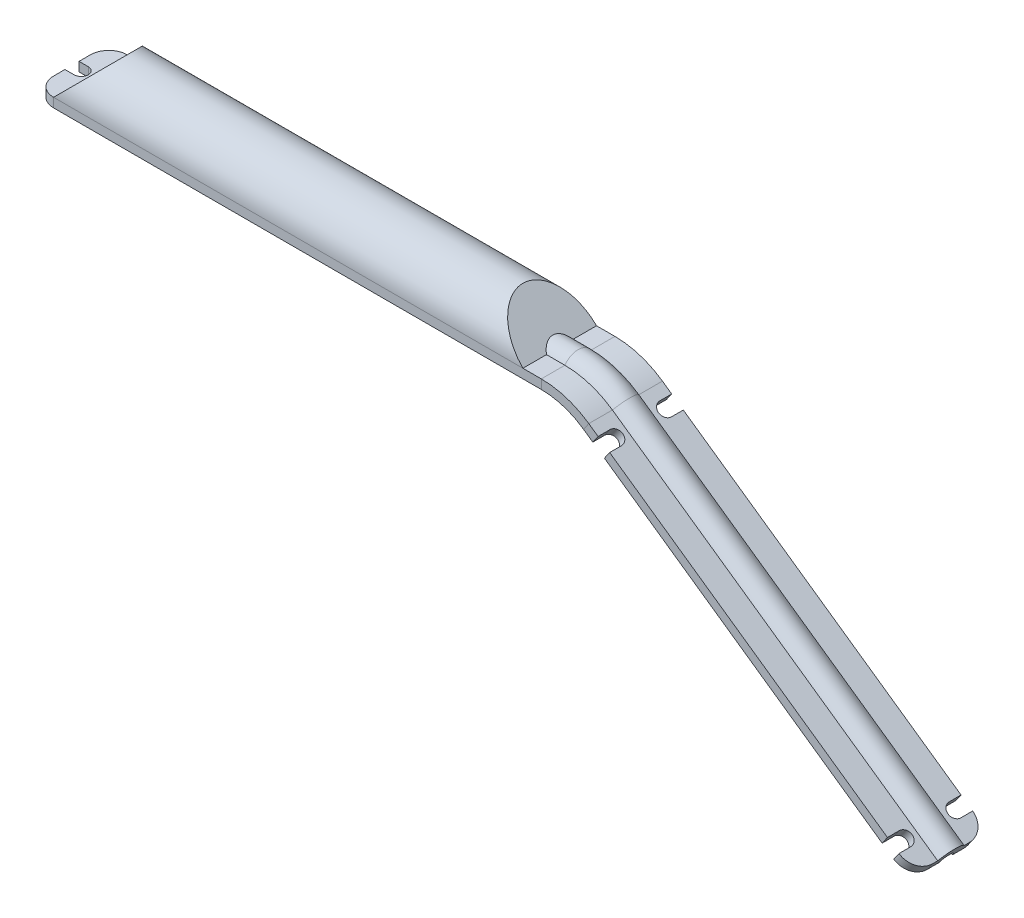
from build123d import *

# Parameters (mm, degrees)
BOSS_EXTRUDE1_DEPTH                          = 3.175
BOSS_EXTRUDE1_DEPTH_BACK                     = 80.9625
CUT_EXTRUDE1_DEPTH                           = 66.747999758
CUT_EXTRUDE2_REACH                           = 123.064
CUT_EXTRUDE2_OFFSET_FROM_SURFACE             = 1.5875
CUT_EXTRUDE2_DIRECTION_2_REACH               = 123.064
CUT_EXTRUDE2_DIRECTION_2_OFFSET_FROM_SURFACE = 1.5875
FILLET2_R                                    = 3.175
CUT_EXTRUDE3_DEPTH                           = 92.97528692
FILLET6_R                                    = 3.175
CUT_EXTRUDE6_DEPTH                           = 98.945839174


with BuildPart() as part:
    # Sketch15 → Boss-Extrude1 (new, two sides: drawn at the far end of the back side and taken through both)
    with BuildSketch(Plane(origin=(0, 0, 0), x_dir=(0, 0, -1), z_dir=(1, 0, 0)).offset(-BOSS_EXTRUDE1_DEPTH_BACK)):
        with BuildLine():
            Line((6.35, 0), (-6.35, 0))
            Line((-6.35, 0), (-6.35, 1.5875))
            ThreePointArc((-6.35, 1.5875), (0, 7.9375), (6.35, 1.5875))
            Line((6.35, 1.5875), (6.35, 0))
        make_face()
    extrude(amount=BOSS_EXTRUDE1_DEPTH + BOSS_EXTRUDE1_DEPTH_BACK)

    # Sketch16 → Cut-Extrude1 (cut, through all)
    with BuildSketch(Plane(origin=(-25.118523266, -23.516899887, -8.308460441), x_dir=(1, 0, 0), z_dir=(0, 0, -1))):
        Polygon((-55.843976734, -25.104399887), (-52.668976734, -25.104399887), (-46.318976734, -31.454399887), (-55.843976734, -31.454399887), align=None)
        Polygon((28.293523266, -31.454399887), (28.293523266, -25.104399887), (21.943523266, -31.454399887), align=None)
    extrude(amount=-CUT_EXTRUDE1_DEPTH, mode=Mode.SUBTRACT)

    # Sweep3: sweep along a path in Sketch2
    with BuildLine(Plane.XY) as sweep3_path:
        Line((-3.175, 0), (6.35, 0))
        ThreePointArc((6.35, 0), (10.168963654, -0.587794725), (13.634420742, -2.296769038))
        Line((13.634420742, -2.296769038), (69.749448553, -41.588934518))
    # Sketch1 → Sweep3 (sweep)
    with BuildSketch(Plane(origin=(0, -59.268822518, 0), x_dir=(0, 0, -1), z_dir=(-1, 0, 0))):
        with BuildLine():
            Line((-6.35, -59.268822518), (-1.190625, -59.268822518))
            ThreePointArc((-1.190625, -59.268822518), (0, -60.459447518), (1.190625, -59.268822518))
            Line((1.190625, -59.268822518), (6.35, -59.268822518))
            Line((6.35, -59.268822518), (6.35, -60.856322518))
            Line((6.35, -60.856322518), (2.2798733, -60.856322518))
            ThreePointArc((2.2798733, -60.856322518), (0, -62.046947518), (-2.2798733, -60.856322518))
            Line((-2.2798733, -60.856322518), (-6.35, -60.856322518))
            Line((-6.35, -60.856322518), (-6.35, -59.268822518))
        make_face()
    sweep(path=sweep3_path.line)

    # Cut-Extrude2: up to this face of the body (flat: up to its plane, moved by the offset)
    cut_extrude2_end = Plane(part.part.faces().sort_by_distance((0.338621943, 4.423878057, 0))[0]).offset(-CUT_EXTRUDE2_OFFSET_FROM_SURFACE)
    # Sketch17 → Cut-Extrude2 (cut, up to the picked face)
    with BuildSketch(Plane.ZY.offset(40.48125), mode=Mode.PRIVATE) as cut_extrude2_sk1:
        with BuildLine():
            Line((-4.7625, 0), (4.7625, 0))
            Line((4.7625, 0), (4.7625, 1.5875))
            ThreePointArc((4.7625, 1.5875), (0, 6.35), (-4.7625, 1.5875))
            Line((-4.7625, 1.5875), (-4.7625, 0))
        make_face()
    cut_extrude2_tool1 = split(extrude(cut_extrude2_sk1.sketch, amount=-CUT_EXTRUDE2_REACH, mode=Mode.PRIVATE), bisect_by=cut_extrude2_end, keep=Keep.BOTH, mode=Mode.PRIVATE)
    add(cut_extrude2_tool1.solids().sort_by(Axis((-40.48125, 2.770015, 0), (1, 0, 0)))[0], mode=Mode.SUBTRACT)

    # Cut-Extrude2 direction 2: up to this face of the body (flat: up to its plane, moved by the offset)
    cut_extrude2_direction_2_end = Plane(part.part.faces().sort_by_distance((-75.092476297, 4.282523703, 0))[0]).offset(-CUT_EXTRUDE2_DIRECTION_2_OFFSET_FROM_SURFACE)
    # Sketch17 → Cut-Extrude2 direction 2 (cut, up to the picked face)
    with BuildSketch(Plane.ZY.offset(40.48125), mode=Mode.PRIVATE) as cut_extrude2_direction_2_sk1:
        with BuildLine():
            Line((-4.7625, 0), (4.7625, 0))
            Line((4.7625, 0), (4.7625, 1.5875))
            ThreePointArc((4.7625, 1.5875), (0, 6.35), (-4.7625, 1.5875))
            Line((-4.7625, 1.5875), (-4.7625, 0))
        make_face()
    cut_extrude2_direction_2_tool1 = split(extrude(cut_extrude2_direction_2_sk1.sketch, amount=CUT_EXTRUDE2_DIRECTION_2_REACH, mode=Mode.PRIVATE), bisect_by=cut_extrude2_direction_2_end, keep=Keep.BOTH, mode=Mode.PRIVATE)
    add(cut_extrude2_direction_2_tool1.solids().sort_by(Axis((-40.48125, 2.770015, 0), (-1, 0, 0)))[0], mode=Mode.SUBTRACT)

    # Fillet2
    fillet2_edges = [part.edges().sort_by_distance(p)[0] for p in [
        (-80.9625, 0.79375, 6.35),
        (-80.9625, 0.79375, -6.35),
    ]]
    fillet(fillet2_edges, radius=FILLET2_R)

    # Sketch20 → Cut-Extrude3 (cut, through all)
    with BuildSketch(Plane(origin=(0, 1.5875, 0), x_dir=(1, 0, 0), z_dir=(0, 1, 0))):
        with BuildLine():
            Line((-79.375, 1.2192), (-80.9625, 1.2192))
            Line((-80.9625, 1.2192), (-80.9625, -1.2192))
            Line((-80.9625, -1.2192), (-79.375, -1.2192))
            ThreePointArc((-79.375, -1.2192), (-78.1558, 0), (-79.375, 1.2192))
        make_face()
    extrude(amount=-CUT_EXTRUDE3_DEPTH, mode=Mode.SUBTRACT)

    # Fillet6
    fillet6_edges = [part.edges().sort_by_distance(p)[0] for p in [
        (70.20472485, -40.938732583, 6.35),
        (70.20472485, -40.938732583, -6.35),
    ]]
    fillet(fillet6_edges, radius=FILLET6_R)

    # Sketch22 → Cut-Extrude6 (cut, through all)
    with BuildSketch(Plane(origin=(4.317011237, 6.165330994, 0), x_dir=(0.8191520442889909, -0.5735764363510475, 0), z_dir=(0.5735764363510475, 0.8191520442889909, 0))):
        with BuildLine():
            Line((77.814836223, 4.31493665), (77.814836223, 6.35))
            Line((77.814836223, 6.35), (75.376436223, 6.35))
            Line((75.376436223, 6.35), (75.376436223, 4.31493665))
            ThreePointArc((75.376436223, 4.31493665), (76.595636223, 3.09573665), (77.814836223, 4.31493665))
        make_face()
        with BuildLine():
            Line((75.376436223, -4.31493665), (75.376436223, -6.35))
            Line((75.376436223, -6.35), (77.814836223, -6.35))
            Line((77.814836223, -6.35), (77.814836223, -4.31493665))
            ThreePointArc((77.814836223, -4.31493665), (76.595636223, -3.09573665), (75.376436223, -4.31493665))
        make_face()
        with BuildLine():
            Line((14.441836223, 4.31493665), (14.441836223, 6.35))
            Line((14.441836223, 6.35), (16.880236223, 6.35))
            Line((16.880236223, 6.35), (16.880236223, 4.31493665))
            ThreePointArc((16.880236223, 4.31493665), (15.661036223, 3.09573665), (14.441836223, 4.31493665))
        make_face()
        with BuildLine():
            Line((14.441836223, -4.31493665), (14.441836223, -6.35))
            Line((14.441836223, -6.35), (16.880236223, -6.35))
            Line((16.880236223, -6.35), (16.880236223, -4.31493665))
            ThreePointArc((16.880236223, -4.31493665), (15.661036223, -3.09573665), (14.441836223, -4.31493665))
        make_face()
    extrude(amount=-CUT_EXTRUDE6_DEPTH, mode=Mode.SUBTRACT)


solid = part.part
